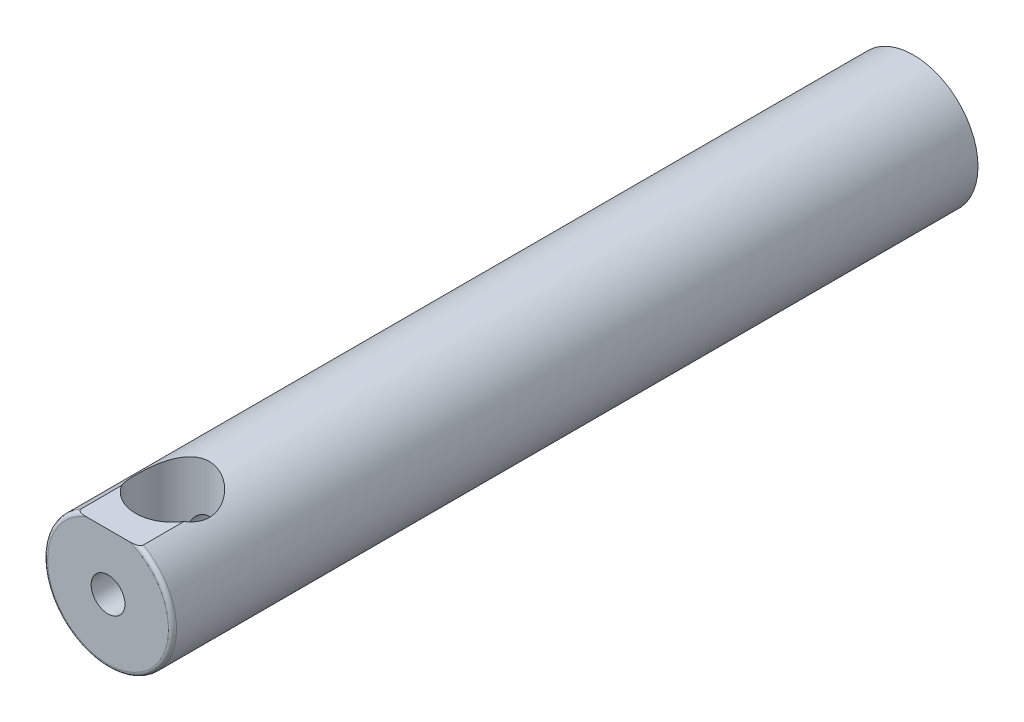
from build123d import *

# Parameters (mm, degrees)
IZIM1_R                     = 8
Y_KSEKLIK_EKSTR_ZYON1_DEPTH = 100
RADYUS1_R                   = 0.5
IZIM4_W                     = 7.745966692
IZIM4_H                     = 1
KES_EKSTR_ZYON2_DEPTH       = 8
CORTAR_EXTRUIR1_DEPTH       = 101.637965119
CORTAR_EXTRUIR1_DEPTH_BACK  = 101.637965119
CROQUIS1_R                  = 4.579234369


with BuildPart() as part:
    # Çizim1 → Yükseklik-Ekstrüzyon1 (new body)
    with BuildSketch(Plane.XY):
        Circle(IZIM1_R)
    extrude(amount=Y_KSEKLIK_EKSTR_ZYON1_DEPTH)

    # Radyus1
    radyus1_edges = [part.edges().sort_by_distance(p)[0] for p in [
        (-8, 0, 100),
    ]]
    fillet(radyus1_edges, radius=RADYUS1_R)

    # Çizim3 → M5x0.8 Tapped Hole1 (revolve, cut)
    with BuildSketch(Plane(origin=(0, 0, 100), x_dir=(0, -1, 0), z_dir=(1, 0, 0))):
        Polygon((0, 0), (0, 23.6618073), (2.1, 22.4), (2.1, 0), align=None)
    revolve(axis=Axis((0, 0, 106.35), (0, 0, -1)), mode=Mode.SUBTRACT)

    # Çizim4 → Kes-Ekstrüzyon2 (cut)
    with BuildSketch(Plane.XY.offset(100)):
        with Locations((0, 7.5)):
            Rectangle(IZIM4_W, IZIM4_H)
    extrude(amount=-KES_EKSTR_ZYON2_DEPTH, mode=Mode.SUBTRACT)

    # Croquis1 → Cortar-Extruir1 (cut, two sides: drawn at the far end of the back side and taken through both)
    with BuildSketch(Plane(origin=(0, 0, 0), x_dir=(1, 0, 0), z_dir=(0, 1, 0)).offset(-CORTAR_EXTRUIR1_DEPTH_BACK)):
        with Locations(Location((0, -92, 0), (0, 0, 270))):
            Circle(CROQUIS1_R)
    extrude(amount=CORTAR_EXTRUIR1_DEPTH + CORTAR_EXTRUIR1_DEPTH_BACK, mode=Mode.SUBTRACT)


solid = part.part
